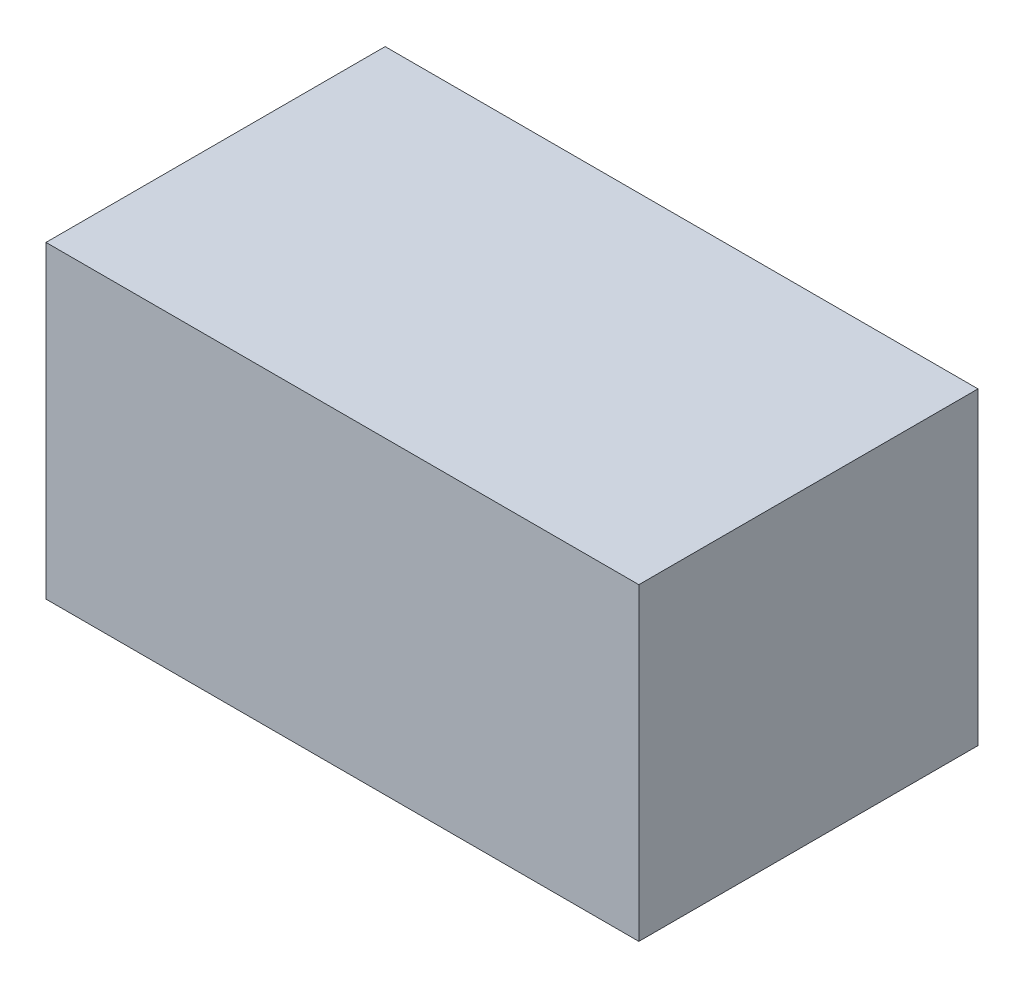
from build123d import *

# Parameters (mm, degrees)
SKETCH2_W           = 68.7
SKETCH2_H           = 39.3
BOSS_EXTRUDE1_DEPTH = 35.8


with BuildPart() as part:
    # Sketch2 → Boss-Extrude1 (new body)
    with BuildSketch(Plane(origin=(0, 0, 0), x_dir=(1, 0, 0), z_dir=(0, 1, 0))):
        with Locations((-6.773239437, -2.668521127)):
            Rectangle(SKETCH2_W, SKETCH2_H)
    extrude(amount=BOSS_EXTRUDE1_DEPTH)


solid = part.part
